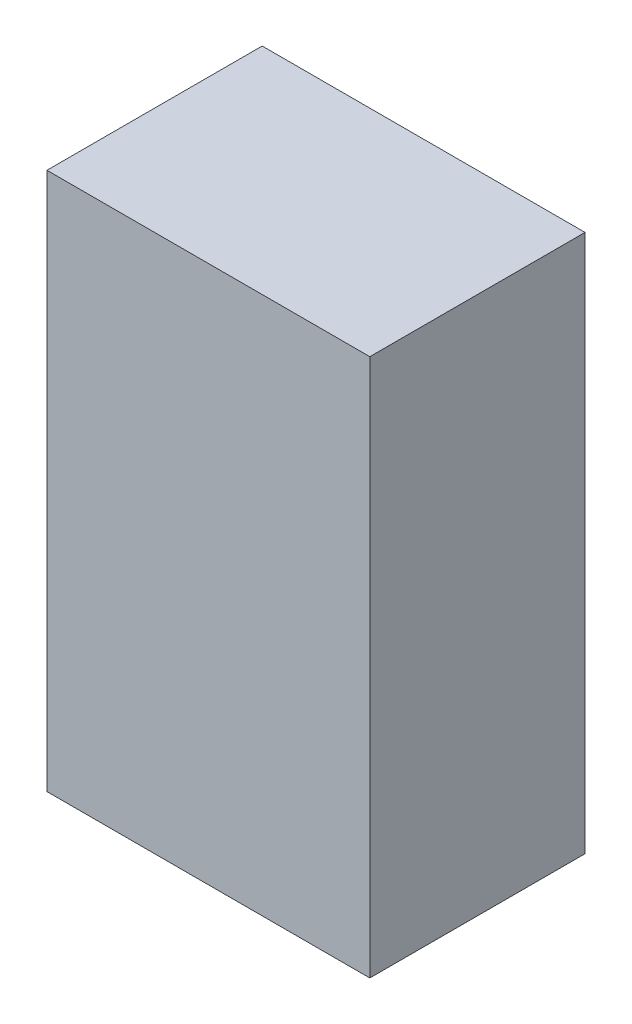
from build123d import *

# Parameters (mm, degrees)
SKETCH1_W           = 12
SKETCH1_H           = 20
BOSS_EXTRUDE1_DEPTH = 8


with BuildPart() as part:
    # Sketch1 → Boss-Extrude1 (new body)
    with BuildSketch(Plane.XY):
        Rectangle(SKETCH1_W, SKETCH1_H)
    extrude(amount=BOSS_EXTRUDE1_DEPTH)


solid = part.part
